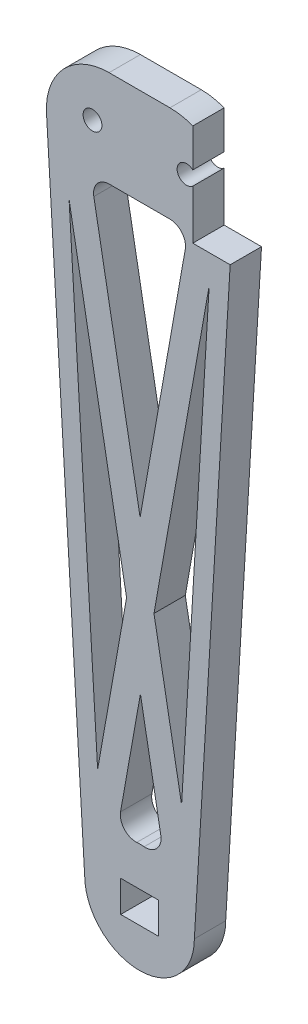
from build123d import *

# Parameters (mm, degrees)
SKETCH1_R           = 3
BOSS_EXTRUDE2_DEPTH = 10
FILLET1_R           = 20
FILLET2_R           = 20
CUT_EXTRUDE1_START  = -10
CUT_EXTRUDE1_DEPTH  = 10
FILLET3_R           = 5
CUT_EXTRUDE4_START  = -10
CUT_EXTRUDE4_DEPTH  = 10


with BuildPart() as part:
    # Sketch1 → Boss-Extrude2 (new body)
    with BuildSketch(Plane.XY):
        with BuildLine():
            Line((-30, 15.770412854), (-30, 0))
            Line((-30, 0), (-17.5, -210))
            ThreePointArc((-17.5, -210), (0, -227.5), (17.5, -210))
            Line((17.5, -210), (30, 0))
            Line((30, 0), (30, 15.770412854))
            Line((30, 15.770412854), (-30, 15.770412854))
        make_face()
        with Locations((-15, 0)):
            Circle(SKETCH1_R, mode=Mode.SUBTRACT)
        with Locations((15, 0)):
            Circle(SKETCH1_R, mode=Mode.SUBTRACT)
        Polygon((0, -205), (6, -205), (6, -215), (-6, -215), (-6, -205), align=None, mode=Mode.SUBTRACT)
    extrude(amount=BOSS_EXTRUDE2_DEPTH)

    # Fillet1
    fillet1_edges = [part.edges().sort_by_distance(p)[0] for p in [
        (-30, 15.770412854, 5),
    ]]
    fillet(fillet1_edges, radius=FILLET1_R)

    # Fillet2
    fillet2_edges = [part.edges().sort_by_distance(p)[0] for p in [
        (30, 15.770412854, 5),
    ]]
    fillet(fillet2_edges, radius=FILLET2_R)

    # Sketch4 → Cut-Extrude1 (cut)
    with BuildSketch(Plane.XY.offset(10).offset(CUT_EXTRUDE1_START)):
        Polygon((-15.651797422, -15), (0.190220551, -102.160979768), (15.643622882, -15), (15, -15), align=None)
        Polygon((-22.473027071, -25.6531452), (-13.367328465, -178.628881795), (-4.134156204, -126.551525408), align=None)
        Polygon((22.230419841, -27.161313899), (4.615986353, -126.511039477), (13.430162671, -175.005634359), align=None)
        with BuildLine():
            Line((0.291609598, -150.901585116), (-7.372445375, -194.128735111))
            ThreePointArc((-7.372445375, -194.128735111), (0.476576628, -192.506490497), (8.225632191, -194.553674383))
            Line((8.225632191, -194.553674383), (0.291609598, -150.901585116))
        make_face()
    extrude(amount=CUT_EXTRUDE1_DEPTH, mode=Mode.SUBTRACT)

    # Fillet3
    fillet3_edges = [part.edges().sort_by_distance(p)[0] for p in [
        (8.225632191, -194.553674383, 5),
        (-7.372445375, -194.128735111, 5),
        (-15.651797422, -15, 5),
        (15.643622882, -15, 5),
    ]]
    fillet(fillet3_edges, radius=FILLET3_R)

    # Sketch5 → Cut-Extrude4 (cut)
    with BuildSketch(Plane.XY.offset(10).offset(CUT_EXTRUDE4_START)):
        with BuildLine():
            Line((29.260488635, 0), (18, 0))
            ThreePointArc((18, 0), (17.738612788, -1.224744871), (17, -2.236067977))
            Line((17, -2.236067977), (17, -18))
            Line((17, -18), (28.928571429, -18))
            Line((28.928571429, -18), (29.677502384, -5.417959945))
            ThreePointArc((29.677502384, -5.417959945), (29.653859351, -2.694751229), (29.260488635, 0))
        make_face()
        with BuildLine():
            ThreePointArc((17, 2.236067977), (17.738612788, 1.224744871), (18, 0))
            Line((18, 0), (29.260488635, 0))
            ThreePointArc((29.260488635, 0), (24.938968919, 8.738256866), (17, 14.39559177))
            Line((17, 14.39559177), (17, 2.236067977))
        make_face()
    extrude(amount=CUT_EXTRUDE4_DEPTH, mode=Mode.SUBTRACT)


solid = part.part
